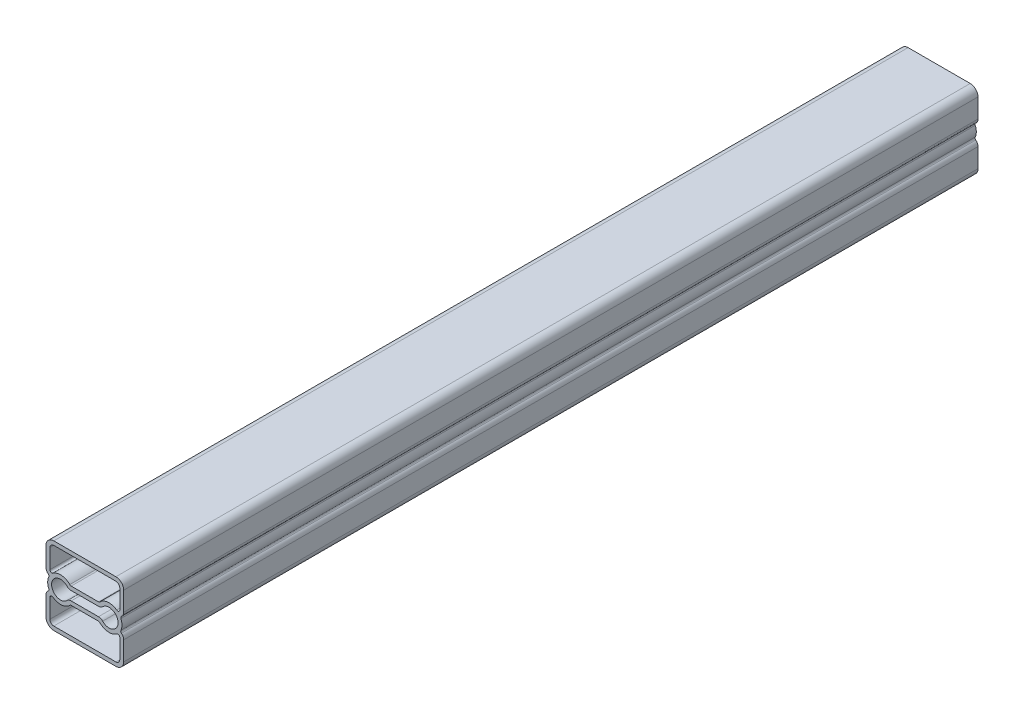
from build123d import *

# Parameters (mm, degrees)
BOSS_EXTRUDE1_DEPTH = 279.4


with BuildPart() as part:
    # Sketch1 → Boss-Extrude1 (new body)
    with BuildSketch(Plane.XY):
        with BuildLine():
            Line((12.7, 3.904831807), (12.7, 10.16))
            ThreePointArc((12.7, 10.16), (11.956051224, 11.956051224), (10.16, 12.7))
            Line((10.16, 12.7), (-10.16, 12.7))
            ThreePointArc((-10.16, 12.7), (-11.956051224, 11.956051224), (-12.7, 10.16))
            Line((-12.7, 10.16), (-12.7, 3.904831807))
            ThreePointArc((-12.7, 3.904831807), (-12.511460601, 3.078521934), (-11.983162199, 2.415773182))
            ThreePointArc((-11.983162199, 2.415773182), (-11.763134535, 2.073265365), (-11.796313868, 1.667527878))
            ThreePointArc((-11.796313868, 1.667527878), (-12.1412, 0), (-11.796313868, -1.667527878))
            ThreePointArc((-11.796313868, -1.667527878), (-11.763134535, -2.073265365), (-11.983162199, -2.415773182))
            ThreePointArc((-11.983162199, -2.415773182), (-12.511460601, -3.078521934), (-12.7, -3.904831807))
            Line((-12.7, -3.904831807), (-12.7, -10.16))
            ThreePointArc((-12.7, -10.16), (-11.956051224, -11.956051224), (-10.16, -12.7))
            Line((-10.16, -12.7), (10.16, -12.7))
            ThreePointArc((10.16, -12.7), (11.956051224, -11.956051224), (12.7, -10.16))
            Line((12.7, -10.16), (12.7, -3.904831807))
            ThreePointArc((12.7, -3.904831807), (12.511460601, -3.078521934), (11.983162199, -2.415773182))
            ThreePointArc((11.983162199, -2.415773182), (11.763134535, -2.073265365), (11.796313868, -1.667527878))
            ThreePointArc((11.796313868, -1.667527878), (12.1412, 0), (11.796313868, 1.667527878))
            ThreePointArc((11.796313868, 1.667527878), (11.763134535, 2.073265365), (11.983162199, 2.415773182))
            ThreePointArc((11.983162199, 2.415773182), (12.511460601, 3.078521934), (12.7, 3.904831807))
        make_face()
        with BuildLine():
            Line((4.467104451, -1.46685), (-4.467104451, -1.46685))
            ThreePointArc((-4.467104451, -1.46685), (-5.208770649, -1.617154514), (-5.833401911, -2.04435))
            ThreePointArc((-5.833401911, -2.04435), (-10.8712, 0), (-5.833401911, 2.04435))
            ThreePointArc((-5.833401911, 2.04435), (-5.208770649, 1.617154514), (-4.467104451, 1.46685))
            Line((-4.467104451, 1.46685), (4.467104451, 1.46685))
            ThreePointArc((4.467104451, 1.46685), (5.208770649, 1.617154514), (5.833401911, 2.04435))
            ThreePointArc((5.833401911, 2.04435), (10.8712, 0), (5.833401911, -2.04435))
            ThreePointArc((5.833401911, -2.04435), (5.208770649, -1.617154514), (4.467104451, -1.46685))
        make_face(mode=Mode.SUBTRACT)
        with BuildLine():
            Line((11.43, 10.16), (11.43, 3.904831807))
            ThreePointArc((11.43, 3.904831807), (11.082315158, 3.338550075), (10.42, 3.392386688))
            ThreePointArc((10.42, 3.392386688), (7.584682807, 4.188867833), (4.922536938, 2.92935))
            ThreePointArc((4.922536938, 2.92935), (4.714326517, 2.786951505), (4.467104451, 2.73685))
            Line((4.467104451, 2.73685), (-4.467104451, 2.73685))
            ThreePointArc((-4.467104451, 2.73685), (-4.714326517, 2.786951505), (-4.922536938, 2.92935))
            ThreePointArc((-4.922536938, 2.92935), (-7.584682807, 4.188867833), (-10.42, 3.392386688))
            ThreePointArc((-10.42, 3.392386688), (-11.082315158, 3.338550075), (-11.43, 3.904831807))
            Line((-11.43, 3.904831807), (-11.43, 10.16))
            ThreePointArc((-11.43, 10.16), (-11.058025612, 11.058025612), (-10.16, 11.43))
            Line((-10.16, 11.43), (10.16, 11.43))
            ThreePointArc((10.16, 11.43), (11.058025612, 11.058025612), (11.43, 10.16))
        make_face(mode=Mode.SUBTRACT)
        with BuildLine():
            Line((11.43, -3.904831807), (11.43, -10.16))
            ThreePointArc((11.43, -10.16), (11.058025612, -11.058025612), (10.16, -11.43))
            Line((10.16, -11.43), (-10.16, -11.43))
            ThreePointArc((-10.16, -11.43), (-11.058025612, -11.058025612), (-11.43, -10.16))
            Line((-11.43, -10.16), (-11.43, -3.904831807))
            ThreePointArc((-11.43, -3.904831807), (-11.082315158, -3.338550075), (-10.42, -3.392386688))
            ThreePointArc((-10.42, -3.392386688), (-7.584682807, -4.188867833), (-4.922536938, -2.92935))
            ThreePointArc((-4.922536938, -2.92935), (-4.714326517, -2.786951505), (-4.467104451, -2.73685))
            Line((-4.467104451, -2.73685), (4.467104451, -2.73685))
            ThreePointArc((4.467104451, -2.73685), (4.714326517, -2.786951505), (4.922536938, -2.92935))
            ThreePointArc((4.922536938, -2.92935), (7.584682807, -4.188867833), (10.42, -3.392386688))
            ThreePointArc((10.42, -3.392386688), (11.082315158, -3.338550075), (11.43, -3.904831807))
        make_face(mode=Mode.SUBTRACT)
    extrude(amount=-BOSS_EXTRUDE1_DEPTH)


solid = part.part
